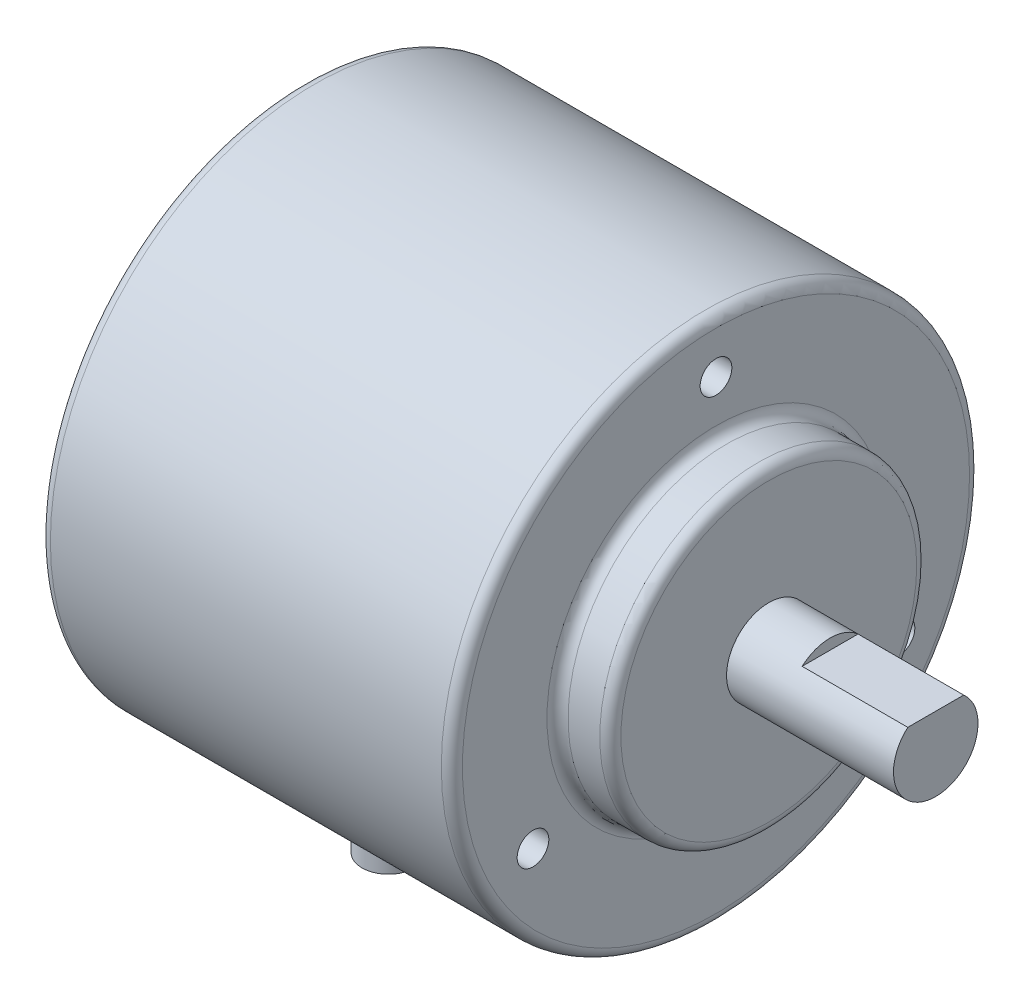
from build123d import *

# Parameters (mm, degrees)
SKETCH2_R                       = 25
BOSS_EXTRUDE1_DEPTH             = 39
SKETCH3_R                       = 15
BOSS_EXTRUDE2_DEPTH             = 5
SKETCH4_R                       = 4
BOSS_EXTRUDE3_DEPTH             = 15.8
CUT_EXTRUDE1_START              = -10
CUT_EXTRUDE1_DEPTH              = 10
SKETCH6_R                       = 1.5
CUT_EXTRUDE2_DEPTH              = 7
BOSS_EXTRUDE4_REACH             = 80.905
BOSS_EXTRUDE4_END_RADIUS        = 25
SKETCH8_R                       = 4
BOSS_EXTRUDE4_DIRECTION_2_DEPTH = 7.5
SKETCH9_R                       = 2.5
BOSS_EXTRUDE5_DEPTH             = 7
FILLET1_R                       = 1


with BuildPart() as part:
    # Sketch2 → Boss-Extrude1 (new body)
    with BuildSketch(Plane(origin=(0, 0, 0), x_dir=(0, 0, -1), z_dir=(1, 0, 0))):
        Circle(SKETCH2_R)
    extrude(amount=BOSS_EXTRUDE1_DEPTH)

    # Sketch3 → Boss-Extrude2 (add)
    with BuildSketch(Plane(origin=(39, 0, 0), x_dir=(0, 0, -1), z_dir=(1, 0, 0))):
        Circle(SKETCH3_R)
    extrude(amount=BOSS_EXTRUDE2_DEPTH)

    # Sketch4 → Boss-Extrude3 (add)
    with BuildSketch(Plane(origin=(44, 0, 0), x_dir=(0, 0, -1), z_dir=(1, 0, 0))):
        Circle(SKETCH4_R)
    extrude(amount=BOSS_EXTRUDE3_DEPTH)

    # Sketch5 → Cut-Extrude1 (cut)
    with BuildSketch(Plane(origin=(59.8, 0, 0), x_dir=(0, 0, -1), z_dir=(1, 0, 0)).offset(CUT_EXTRUDE1_START)):
        with BuildLine():
            Line((-2.645751311, 3), (2.645751311, 3))
            ThreePointArc((2.645751311, 3), (0, 4), (-2.645751311, 3))
        make_face()
    extrude(amount=CUT_EXTRUDE1_DEPTH, mode=Mode.SUBTRACT)

    # Sketch6 → Cut-Extrude2 (cut)
    with BuildSketch(Plane(origin=(39, 0, 0), x_dir=(0, 0, -1), z_dir=(1, 0, 0))):
        with Locations((0, 20)):
            Circle(SKETCH6_R)
        with Locations((17.320508076, -10)):
            Circle(SKETCH6_R)
        with Locations((-17.320508076, -10)):
            Circle(SKETCH6_R)
    extrude(amount=-CUT_EXTRUDE2_DEPTH, mode=Mode.SUBTRACT)

    # Boss-Extrude4: up to this cylinder (the profile starts inside it)
    boss_extrude4_end = Plane(origin=(8, 0, 0), z_dir=(-1, 0, 0)) * Cylinder(BOSS_EXTRUDE4_END_RADIUS, 212.81, mode=Mode.PRIVATE)
    # Sketch8 → Boss-Extrude4 (add, up to the surface)
    with BuildSketch(Plane(origin=(0, -20, 0), x_dir=(1, 0, 0), z_dir=(0, 1, 0)), mode=Mode.PRIVATE) as boss_extrude4_sk1:
        with Locations((8, 0)):
            Circle(SKETCH8_R)
    boss_extrude4_tool1 = extrude(boss_extrude4_sk1.sketch, amount=BOSS_EXTRUDE4_REACH, mode=Mode.PRIVATE) & boss_extrude4_end
    add(boss_extrude4_tool1.solids().sort_by_distance((8, -20, 0))[0])

    # Sketch8 → Boss-Extrude4 direction 2 (add)
    with BuildSketch(Plane(origin=(0, -20, 0), x_dir=(1, 0, 0), z_dir=(0, 1, 0))):
        with Locations((8, 0)):
            Circle(SKETCH8_R)
    extrude(amount=-BOSS_EXTRUDE4_DIRECTION_2_DEPTH)

    # Sketch9 → Boss-Extrude5 (add)
    with BuildSketch(Plane.XZ.offset(27.5)):
        with Locations((8, 0)):
            Circle(SKETCH9_R)
    extrude(amount=BOSS_EXTRUDE5_DEPTH)

    # Fillet1
    fillet1_edges = [part.edges().sort_by_distance(p)[0] for p in [
        (0, 0, 25),
        (39, 0, 25),
        (4, -25, 0),
        (5.5, -27.5, 0),
        (39, 0, 15),
        (44, 0, 15),
    ]]
    fillet(fillet1_edges, radius=FILLET1_R)


solid = part.part
